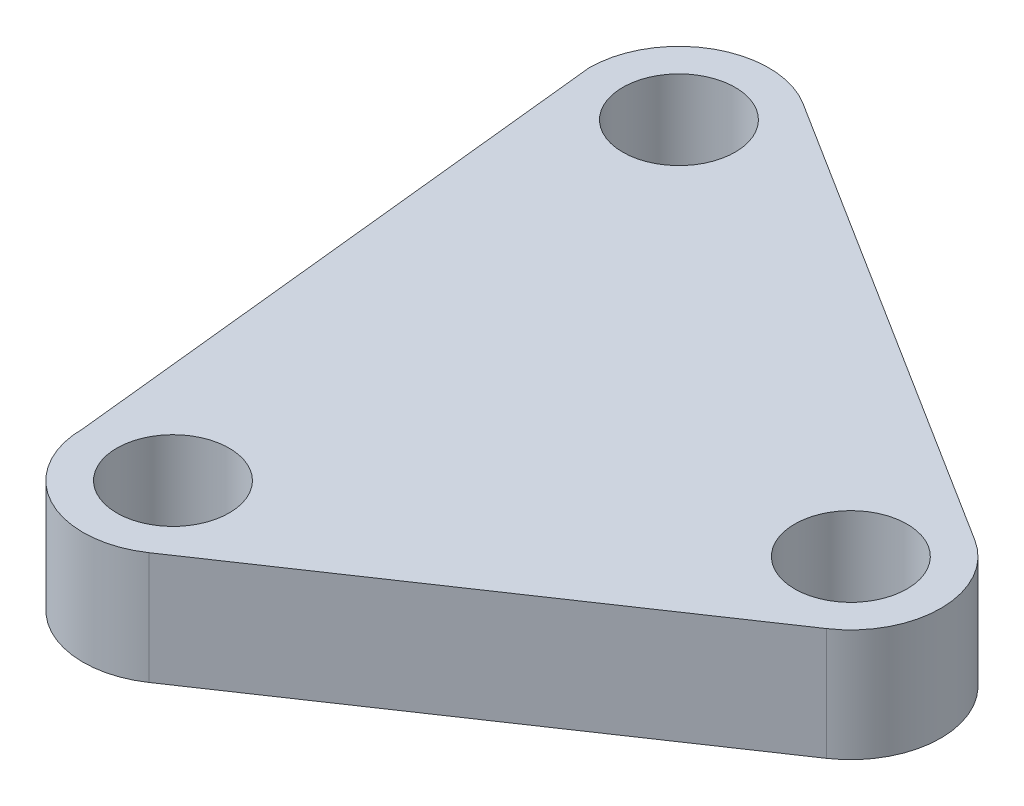
from build123d import *

# Parameters (mm, degrees)
SKETCH1_R           = 2.5
BOSS_EXTRUDE1_DEPTH = 5


with BuildPart() as part:
    # Sketch1 → Boss-Extrude1 (new body)
    with BuildSketch(Plane(origin=(0, 0, 0), x_dir=(1, 0, 0), z_dir=(0, 1, 0))):
        with BuildLine():
            ThreePointArc((-1.35433299, -25.15), (0.768377165, -28.682107422), (4.88355843, -28.465394696))
            Line((4.88355843, -28.465394696), (22.88355843, -16.315394696))
            ThreePointArc((22.88355843, -16.315394696), (24.645161473, -12.936407261), (22.777022974, -9.615133422))
            Line((22.777022974, -9.615133422), (2.131355964, 3.384866578))
            ThreePointArc((2.131355964, 3.384866578), (-1.933206681, 3.501815519), (-4, 0))
            Line((-4, 0), (-1.35433299, -25.15))
        make_face()
        with Locations(Location((2.64566701, -25.15, 0), (0, 0, 270))):
            Circle(SKETCH1_R, mode=Mode.SUBTRACT)
        with Locations(Location((20.64566701, -13, 0), (0, 0, 270))):
            Circle(SKETCH1_R, mode=Mode.SUBTRACT)
        with Locations(Location((0, 0, 0), (0, 0, 270))):
            Circle(SKETCH1_R, mode=Mode.SUBTRACT)
    extrude(amount=BOSS_EXTRUDE1_DEPTH)


solid = part.part
